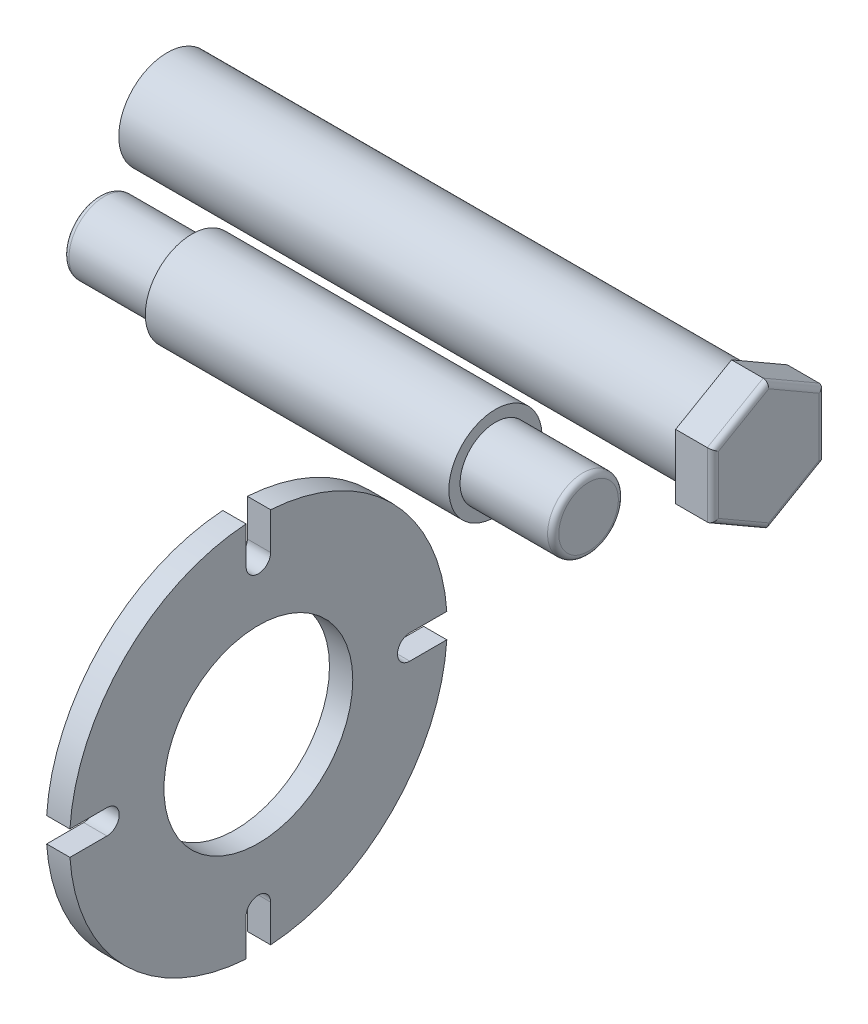
from build123d import *

# Parameters (mm, degrees)
SKETCH2_R           = 12.876739694
BOSS_EXTRUDE1_DEPTH = 3.175
SKETCH3_R           = 4.826
BOSS_EXTRUDE2_DEPTH = 12.7
SKETCH4_R           = 6.35
SKETCH4_R_2         = 4.826
BOSS_EXTRUDE3_DEPTH = 41.402
SKETCH5_R           = 4.826
BOSS_EXTRUDE4_DEPTH = 12.7
SKETCH7_R           = 6.604
BOSS_EXTRUDE5_DEPTH = 76.962
BOSS_EXTRUDE6_DEPTH = 5.08
FILLET1_R           = 0.762
FILLET2_R           = 0.762
FILLET3_R           = 0.762


with BuildPart() as part:
    # Sketch2 → Boss-Extrude1 (new body)
    with BuildSketch(Plane(origin=(0, 0, 0), x_dir=(0, 0, -1), z_dir=(1, 0, 0))):
        with BuildLine():
            Line((20.6502, 1.67397616), (25.699017577, 1.67397616))
            ThreePointArc((25.699017577, 1.67397616), (18.210459914, 18.210459914), (1.67397616, 25.699017577))
            Line((1.67397616, 25.699017577), (1.67397616, 20.6502))
            ThreePointArc((1.67397616, 20.6502), (0, 18.97622384), (-1.67397616, 20.6502))
            Line((-1.67397616, 20.6502), (-1.67397616, 25.699017577))
            ThreePointArc((-1.67397616, 25.699017577), (-18.210459914, 18.210459914), (-25.699017577, 1.67397616))
            Line((-25.699017577, 1.67397616), (-20.6502, 1.67397616))
            ThreePointArc((-20.6502, 1.67397616), (-18.97622384, 0), (-20.6502, -1.67397616))
            Line((-20.6502, -1.67397616), (-25.699017577, -1.67397616))
            ThreePointArc((-25.699017577, -1.67397616), (-18.210459914, -18.210459914), (-1.67397616, -25.699017577))
            Line((-1.67397616, -25.699017577), (-1.67397616, -20.6502))
            ThreePointArc((-1.67397616, -20.6502), (0, -18.97622384), (1.67397616, -20.6502))
            Line((1.67397616, -20.6502), (1.67397616, -25.699017577))
            ThreePointArc((1.67397616, -25.699017577), (18.210459914, -18.210459914), (25.699017577, -1.67397616))
            Line((25.699017577, -1.67397616), (20.6502, -1.67397616))
            ThreePointArc((20.6502, -1.67397616), (18.97622384, 0), (20.6502, 1.67397616))
        make_face()
        Circle(SKETCH2_R, mode=Mode.SUBTRACT)
    extrude(amount=BOSS_EXTRUDE1_DEPTH)


with BuildPart() as body_2:
    # Sketch3 → Boss-Extrude2 (new body)
    with BuildSketch(Plane(origin=(0, 0, 0), x_dir=(0, 0, -1), z_dir=(1, 0, 0))):
        with Locations((48.208683161, 0)):
            Circle(SKETCH3_R)
    extrude(amount=-BOSS_EXTRUDE2_DEPTH)

    # Fillet1
    fillet1_edges = [body_2.edges().sort_by_distance(p)[0] for p in [
        (0, 0, -43.382683161),
    ]]
    fillet(fillet1_edges, radius=FILLET1_R)


with BuildPart() as body_3:
    # Sketch4 → Boss-Extrude3 (new body)
    with BuildSketch(Plane.ZY.offset(12.7)):
        with Locations((-48.208683161, 0)):
            Circle(SKETCH4_R)
        with Locations((-48.208683161, 0)):
            Circle(SKETCH4_R_2, mode=Mode.SUBTRACT)
    extrude(amount=BOSS_EXTRUDE3_DEPTH)


with BuildPart() as body_4:
    # Sketch5 → Boss-Extrude4 (new body)
    with BuildSketch(Plane.ZY.offset(54.102)):
        with Locations((-48.208683161, 0)):
            Circle(SKETCH5_R)
    extrude(amount=BOSS_EXTRUDE4_DEPTH)

    # Fillet2
    fillet2_edges = [body_4.edges().sort_by_distance(p)[0] for p in [
        (-66.802, 0, -53.034683161),
    ]]
    fillet(fillet2_edges, radius=FILLET2_R)


with BuildPart() as body_5:
    # Sketch7 → Boss-Extrude5 (new body)
    with BuildSketch(Plane(origin=(0, 0, 0), x_dir=(0, 0, -1), z_dir=(1, 0, 0))):
        with Locations((67.702532017, 0)):
            Circle(SKETCH7_R)
    extrude(amount=-BOSS_EXTRUDE5_DEPTH)

    # Sketch8 → Boss-Extrude6 (add)
    with BuildSketch(Plane(origin=(0, 0, 0), x_dir=(0, 0, -1), z_dir=(1, 0, 0))):
        Polygon((67.702532017, -8.798818102), (75.322532017, -4.399409051), (75.322532017, 4.399409051), (67.702532017, 8.798818102), (60.082532017, 4.399409051), (60.082532017, -4.399409051), align=None)
    extrude(amount=BOSS_EXTRUDE6_DEPTH)

    # Fillet3
    fillet3_edges = [body_5.edges().sort_by_distance(p)[0] for p in [
        (5.08, 0, -60.082532017),
        (5.08, -6.599113577, -63.892532017),
        (5.08, -6.599113577, -71.512532017),
        (5.08, 0, -75.322532017),
        (5.08, 6.599113577, -71.512532017),
        (5.08, 6.599113577, -63.892532017),
    ]]
    fillet(fillet3_edges, radius=FILLET3_R)


solid = Compound([part.part, body_2.part, body_3.part, body_4.part, body_5.part])
